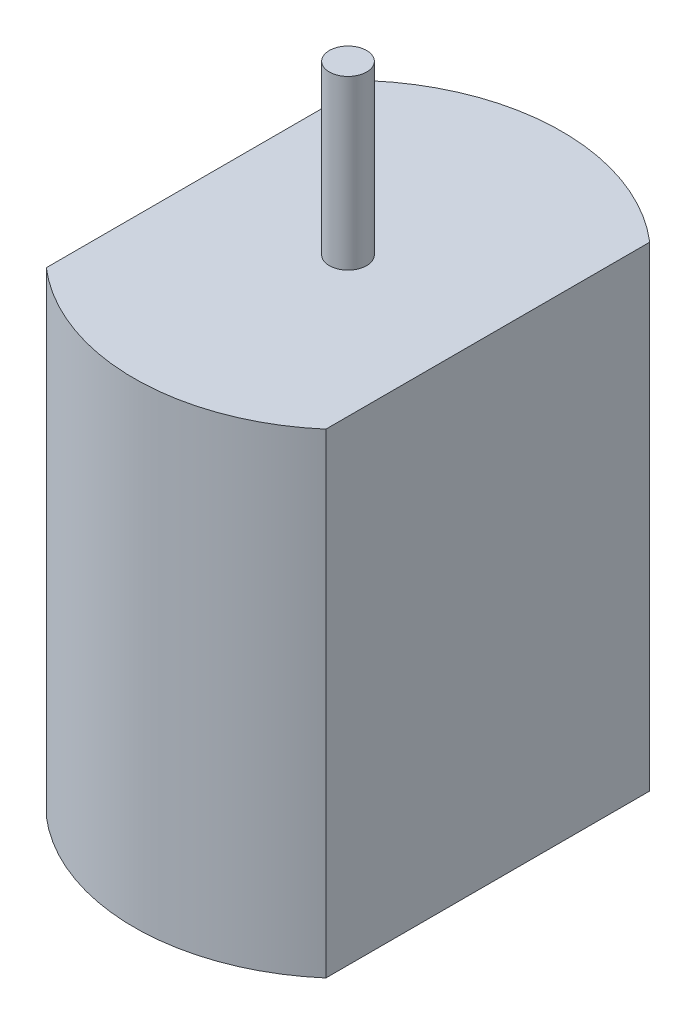
from build123d import *

# Parameters (mm, degrees)
BOSS_EXTRUDE1_DEPTH = 25.5
SKETCH2_R           = 1
BOSS_EXTRUDE2_DEPTH = 9


with BuildPart() as part:
    # Sketch1 → Boss-Extrude1 (new body)
    with BuildSketch(Plane(origin=(0, 0, 0), x_dir=(1, 0, 0), z_dir=(0, 1, 0))):
        with BuildLine():
            Line((7.5, 8.686420997), (7.5, -8.686420997))
            ThreePointArc((7.5, -8.686420997), (0, -11.476232384), (-7.5, -8.686420997))
            Line((-7.5, -8.686420997), (-7.5, 8.686420997))
            ThreePointArc((-7.5, 8.686420997), (0, 11.476232384), (7.5, 8.686420997))
        make_face()
    extrude(amount=BOSS_EXTRUDE1_DEPTH)

    # Sketch2 → Boss-Extrude2 (add)
    with BuildSketch(Plane(origin=(0, 25.5, 0), x_dir=(1, 0, 0), z_dir=(0, 1, 0))):
        with Locations(Location((0, 0, 0), (0, 0, 270))):
            Circle(SKETCH2_R)
    extrude(amount=BOSS_EXTRUDE2_DEPTH)


solid = part.part
